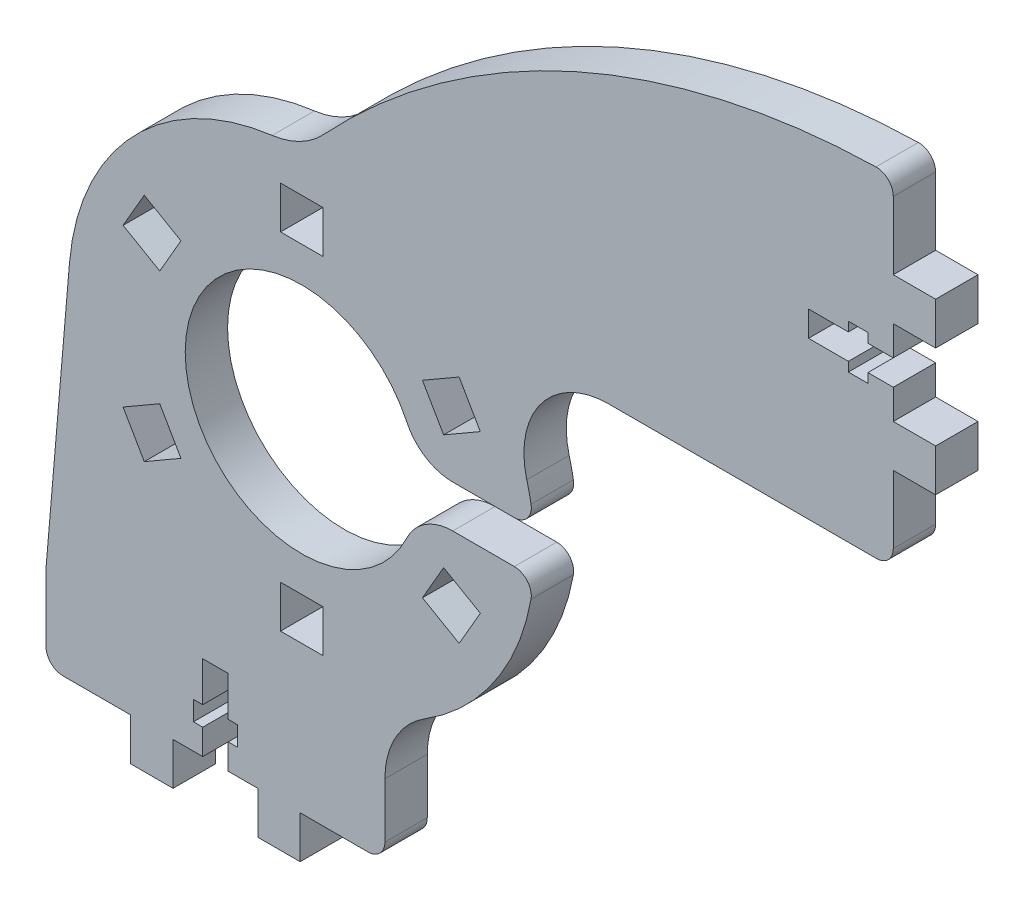
from build123d import *

# Parameters (mm, degrees)
ESQUISSE1_W        = 5
ESQUISSE1_H        = 5
BOSS_EXTRU_1_DEPTH = 5


with BuildPart() as part:
    # Esquisse1 → Boss.-Extru.1 (new body)
    with BuildSketch(Plane.XY):
        with BuildLine():
            Line((-62, 0), (-70, 0))
            Line((-70, 0), (-70, -5))
            Line((-70, -5), (-75, -5))
            Line((-75, -5), (-75, 0))
            Line((-75, 0), (-78.5, 0))
            Line((-78.5, 0), (-78.5, 3))
            Line((-78.5, 3), (-77.4, 3))
            Line((-77.4, 3), (-77.4, 5.3))
            Line((-77.4, 5.3), (-78.5, 5.3))
            Line((-78.5, 5.3), (-78.5, 10))
            Line((-78.5, 10), (-81.5, 10))
            Line((-81.5, 10), (-81.5, 5.3))
            Line((-81.5, 5.3), (-82.6, 5.3))
            Line((-82.6, 5.3), (-82.6, 3))
            Line((-82.6, 3), (-81.5, 3))
            Line((-81.5, 3), (-81.5, 0))
            Line((-81.5, 0), (-85, 0))
            Line((-85, 0), (-85, -5))
            Line((-85, -5), (-90, -5))
            Line((-90, -5), (-90, 0))
            Line((-90, 0), (-98, 0))
            ThreePointArc((-98, 0), (-99.414213562, 0.585786438), (-100, 2))
            Line((-100, 2), (-100, 10))
            Line((-100, 10), (-97.222166499, 42.643036354))
            ThreePointArc((-97.222166499, 42.643036354), (-89.672333618, 59.342381794), (-73.306153302, 67.589578681))
            ThreePointArc((-73.306153302, 67.589578681), (-70.002900284, 68.614551275), (-67.24637377, 70.70347705))
            ThreePointArc((-67.24637377, 70.70347705), (-37.614790527, 91.960082654), (-2.044554135, 99.999503671))
            ThreePointArc((-2.044554135, 99.999503671), (-0.601627423, 99.429879063), (0, 98))
            Line((0, 98), (0, 90))
            Line((0, 90), (5, 90))
            Line((5, 90), (5, 85))
            Line((5, 85), (0, 85))
            Line((0, 85), (0, 81.5))
            Line((0, 81.5), (-3, 81.5))
            Line((-3, 81.5), (-3, 82.6))
            Line((-3, 82.6), (-5.3, 82.6))
            Line((-5.3, 82.6), (-5.3, 81.5))
            Line((-5.3, 81.5), (-10, 81.5))
            Line((-10, 81.5), (-10, 78.5))
            Line((-10, 78.5), (-5.3, 78.5))
            Line((-5.3, 78.5), (-5.3, 77.4))
            Line((-5.3, 77.4), (-3, 77.4))
            Line((-3, 77.4), (-3, 78.5))
            Line((-3, 78.5), (0, 78.5))
            Line((0, 78.5), (0, 75))
            Line((0, 75), (5, 75))
            Line((5, 75), (5, 70))
            Line((5, 70), (0, 70))
            Line((0, 70), (0, 62))
            ThreePointArc((0, 62), (-0.585786438, 60.585786438), (-2, 60))
            Line((-2, 60), (-33.594430088, 60))
            ThreePointArc((-33.594430088, 60), (-41.52653458, 56.08947603), (-43.254902123, 47.416343664))
            ThreePointArc((-43.254902123, 47.416343664), (-42.980213788, 46.295555399), (-42.752787596, 45.164229918))
            ThreePointArc((-42.752787596, 45.164229918), (-43.187469445, 43.527910846), (-44.721399423, 42.811288741))
            Line((-44.721399423, 42.811288741), (-51.993903733, 42.811288741))
            ThreePointArc((-51.993903733, 42.811288741), (-55.195960034, 43.737154782), (-57.409791273, 46.22901026))
            ThreePointArc((-57.409791273, 46.22901026), (-83.571200219, 40.311288741), (-57.409791273, 34.393567223))
            ThreePointArc((-57.409791273, 34.393567223), (-55.195960034, 36.885422701), (-51.993903733, 37.811288741))
            Line((-51.993903733, 37.811288741), (-44.721399423, 37.811288741))
            ThreePointArc((-44.721399423, 37.811288741), (-43.187469445, 37.094666637), (-42.752787596, 35.458347565))
            ThreePointArc((-42.752787596, 35.458347565), (-47.057034679, 24.882654088), (-55.285653392, 16.96674166))
            ThreePointArc((-55.285653392, 16.96674166), (-58.742326175, 13.332888367), (-60, 8.477815449))
            Line((-60, 8.477815449), (-60, 2))
            ThreePointArc((-60, 2), (-60.585786438, 0.585786438), (-62, 0))
        make_face()
        with Locations((-69.821200219, 60.711288741)):
            Rectangle(ESQUISSE1_W, ESQUISSE1_H, mode=Mode.SUBTRACT)
        Polygon((-51.239218472, 53.926352251), (-48.739218472, 49.596225232), (-53.069345491, 47.096225232), (-55.569345491, 51.426352251), align=None, mode=Mode.SUBTRACT)
        Polygon((-48.739218472, 31.026352251), (-51.239218472, 26.696225232), (-55.569345491, 29.196225232), (-53.069345491, 33.526352251), align=None, mode=Mode.SUBTRACT)
        with Locations((-69.821200219, 19.911288741)):
            Rectangle(ESQUISSE1_W, ESQUISSE1_H, mode=Mode.SUBTRACT)
        Polygon((-88.403181966, 26.696225232), (-90.903181966, 31.026352251), (-86.573054947, 33.526352251), (-84.073054947, 29.196225232), align=None, mode=Mode.SUBTRACT)
        Polygon((-90.903181966, 49.596225232), (-88.403181966, 53.926352251), (-84.073054947, 51.426352251), (-86.573054947, 47.096225232), align=None, mode=Mode.SUBTRACT)
    extrude(amount=BOSS_EXTRU_1_DEPTH)


solid = part.part
